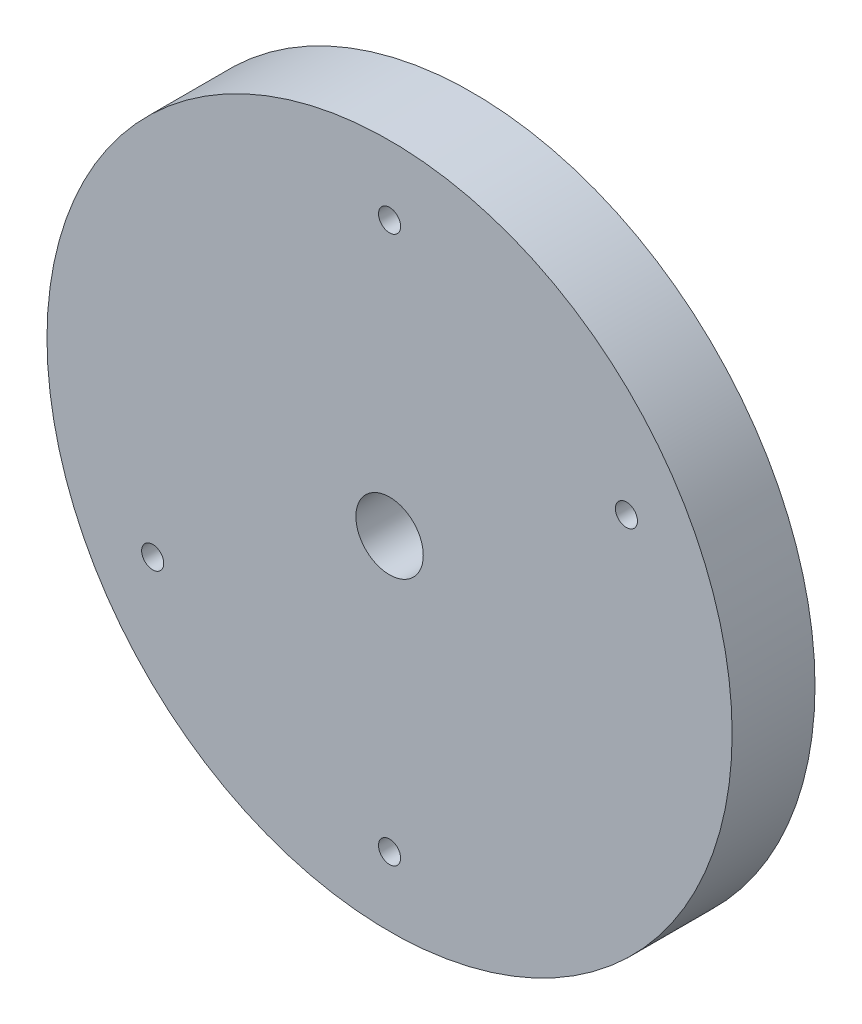
from build123d import *

# Parameters (mm, degrees)
SKETCH1_R                   = 62
BOSS_EXTRUDE1_DEPTH         = 15
SKETCH2_R                   = 2
CUT_EXTRUDE1_DEPTH          = 15
CIRPATTERN1_COUNT           = 2
CIRPATTERN1_ANGLE           = 60
CIRPATTERN2_COUNT           = 2
CIRPATTERN2_COPY_1_SKETCH_R = 2
CIRPATTERN2_COPY_1_DEPTH    = 15
SKETCH3_R                   = 6.1
CUT_EXTRUDE2_DEPTH          = 15


with BuildPart() as part:
    # Sketch1 → Boss-Extrude1 (new body)
    with BuildSketch(Plane.XY):
        Circle(SKETCH1_R)
    extrude(amount=BOSS_EXTRUDE1_DEPTH)

    # Sketch2 → Cut-Extrude1 (cut)
    with BuildSketch(Plane.XY.offset(15)):
        with Locations((0, 49.5)):
            Circle(SKETCH2_R)
    cut_extrude1 = extrude(amount=-CUT_EXTRUDE1_DEPTH, mode=Mode.SUBTRACT)

    # CirPattern1: Cut-Extrude1 ×2 about axis
    cirpattern1_axis = Axis((0, 0, 15), (0, 0, -1))
    for i in range(1, CIRPATTERN1_COUNT):
        add(cut_extrude1.rotate(cirpattern1_axis, i * CIRPATTERN1_ANGLE / (CIRPATTERN1_COUNT - 1)), mode=Mode.SUBTRACT)

    # CirPattern2: Cut-Extrude1 ×2 about axis
    cirpattern2_axis = Axis((0, 0, 15), (0, 0, -1))
    for i in range(1, CIRPATTERN2_COUNT):
        add(cut_extrude1.rotate(cirpattern2_axis, i * 360 / CIRPATTERN2_COUNT), mode=Mode.SUBTRACT)

    # CirPattern2 copy 1 sketch → CirPattern2 copy 1 (cut)
    with BuildSketch(Plane(origin=(0, 0, 15), x_dir=(-0.4999999999999979, 0.8660254037844398, 0), z_dir=(0, 0, 1))):
        with Locations((0, 49.5)):
            Circle(CIRPATTERN2_COPY_1_SKETCH_R)
    extrude(amount=-CIRPATTERN2_COPY_1_DEPTH, mode=Mode.SUBTRACT)

    # Sketch3 → Cut-Extrude2 (cut)
    with BuildSketch(Plane.XY.offset(15)):
        Circle(SKETCH3_R)
    extrude(amount=-CUT_EXTRUDE2_DEPTH, mode=Mode.SUBTRACT)


solid = part.part
